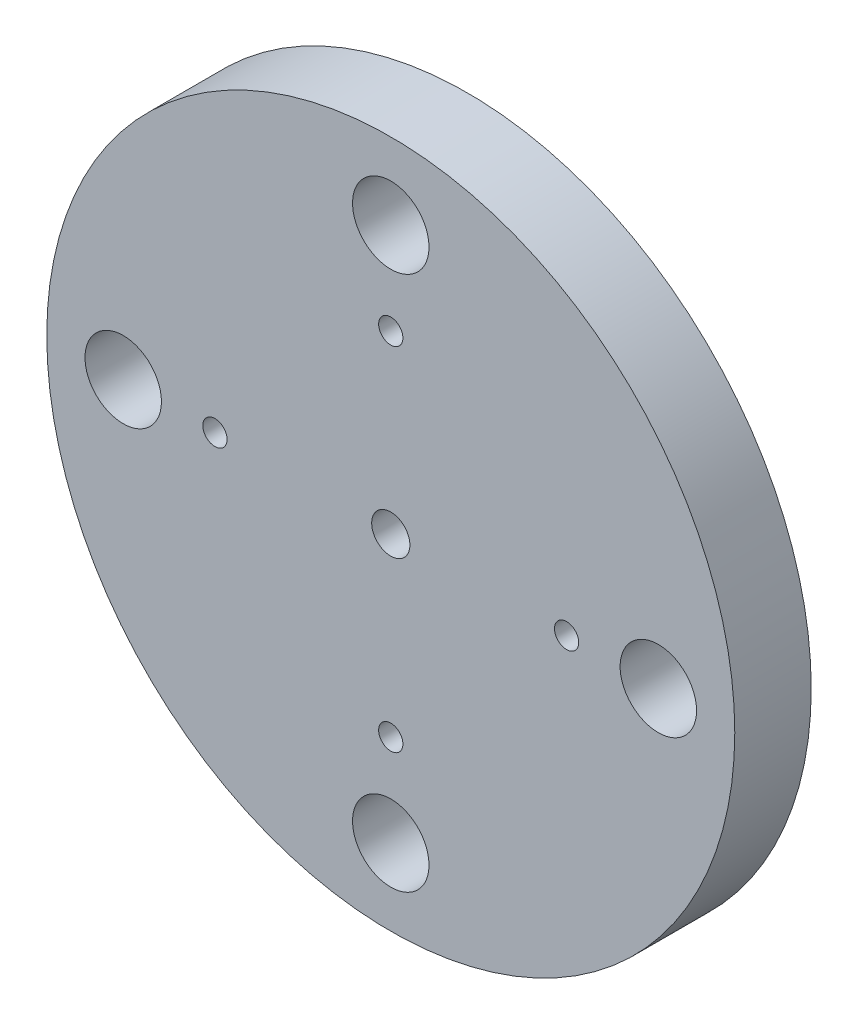
from build123d import *

# Parameters (mm, degrees)
SKETCH2_R                    = 45
BOSS_EXTRUDE1_DEPTH          = 10
SKETCH3_R                    = 2.5
CUT_EXTRUDE1_DEPTH           = 65.420493634
SKETCH4_R                    = 5
CUT_EXTRUDE2_DEPTH           = 10
F_1_8_0_125_DIAMETER_HOLE1_D = 3.175


with BuildPart() as part:
    # Sketch2 → Boss-Extrude1 (new body)
    with BuildSketch(Plane.XY):
        Circle(SKETCH2_R)
    extrude(amount=BOSS_EXTRUDE1_DEPTH)

    # Sketch3 → Cut-Extrude1 (cut, through all)
    with BuildSketch(Plane(origin=(0, 0, 0), x_dir=(-1, 0, 0), z_dir=(0, 0, -1))):
        Circle(SKETCH3_R)
    extrude(amount=-CUT_EXTRUDE1_DEPTH, mode=Mode.SUBTRACT)

    # Sketch4 → Cut-Extrude2 (cut)
    with BuildSketch(Plane.XY.offset(10)):
        with Locations((0, 35)):
            Circle(SKETCH4_R)
        with Locations((35, 0)):
            Circle(SKETCH4_R)
        with Locations((0, -35)):
            Circle(SKETCH4_R)
        with Locations((-35, 0)):
            Circle(SKETCH4_R)
    extrude(amount=-CUT_EXTRUDE2_DEPTH, mode=Mode.SUBTRACT)

    # 1/8 (0.125) Diameter Hole1 (through all)
    with Locations(Plane.XY.offset(10)):
        with Locations((0, 23), (23, 0), (0, -23), (-23, 0)):
            Hole(F_1_8_0_125_DIAMETER_HOLE1_D / 2)


solid = part.part
